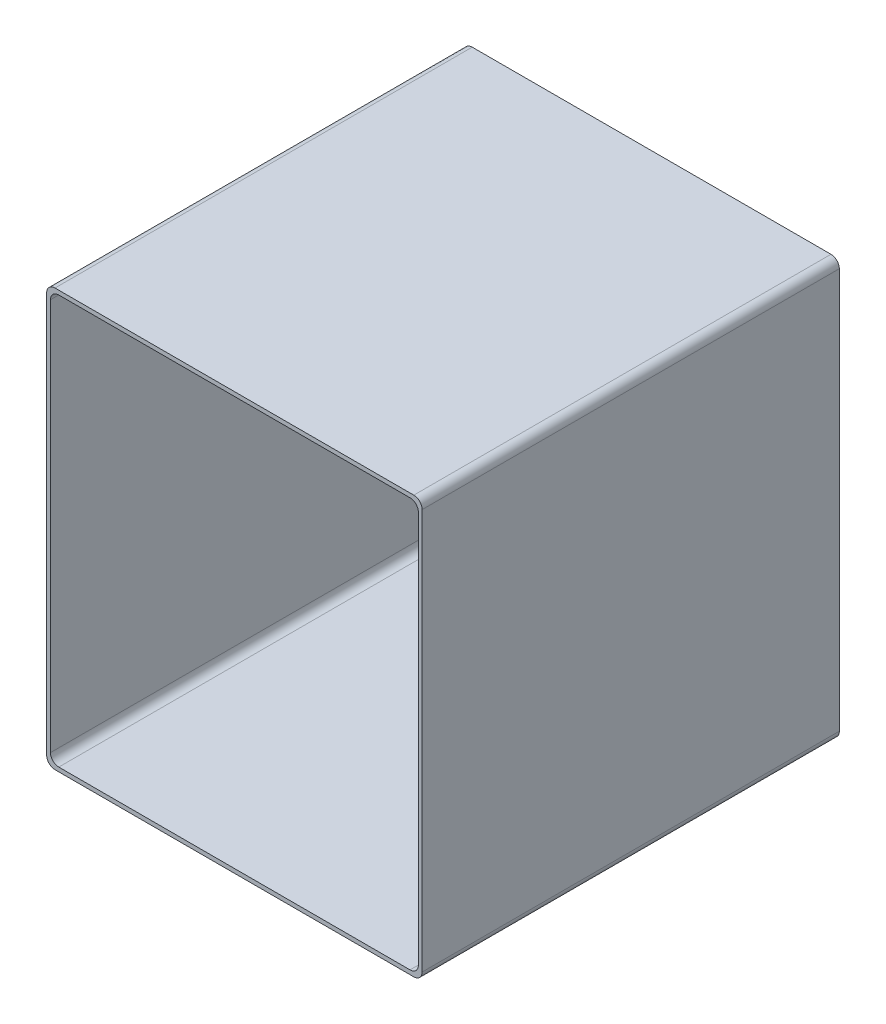
from build123d import *

# Parameters (mm, degrees)
SKETCH2_W           = 450
SKETCH2_H           = 500
SKETCH2_W_2         = 441
SKETCH2_H_2         = 490
BOSS_EXTRUDE1_DEPTH = 500
FILLET1_R           = 10


with BuildPart() as part:
    # Sketch2 → Boss-Extrude1 (new body)
    with BuildSketch(Plane.XY):
        with Locations((225, 250)):
            Rectangle(SKETCH2_W, SKETCH2_H)
        with Locations((225, 250)):
            Rectangle(SKETCH2_W_2, SKETCH2_H_2, mode=Mode.SUBTRACT)
    extrude(amount=BOSS_EXTRUDE1_DEPTH)

    # Fillet1
    fillet1_edges = [part.edges().sort_by_distance(p)[0] for p in [
        (4.5, 495, 250),
        (4.5, 5, 250),
        (445.5, 5, 250),
        (445.5, 495, 250),
        (0, 500, 250),
        (450, 500, 250),
        (450, 0, 250),
        (0, 0, 250),
    ]]
    fillet(fillet1_edges, radius=FILLET1_R)


solid = part.part
